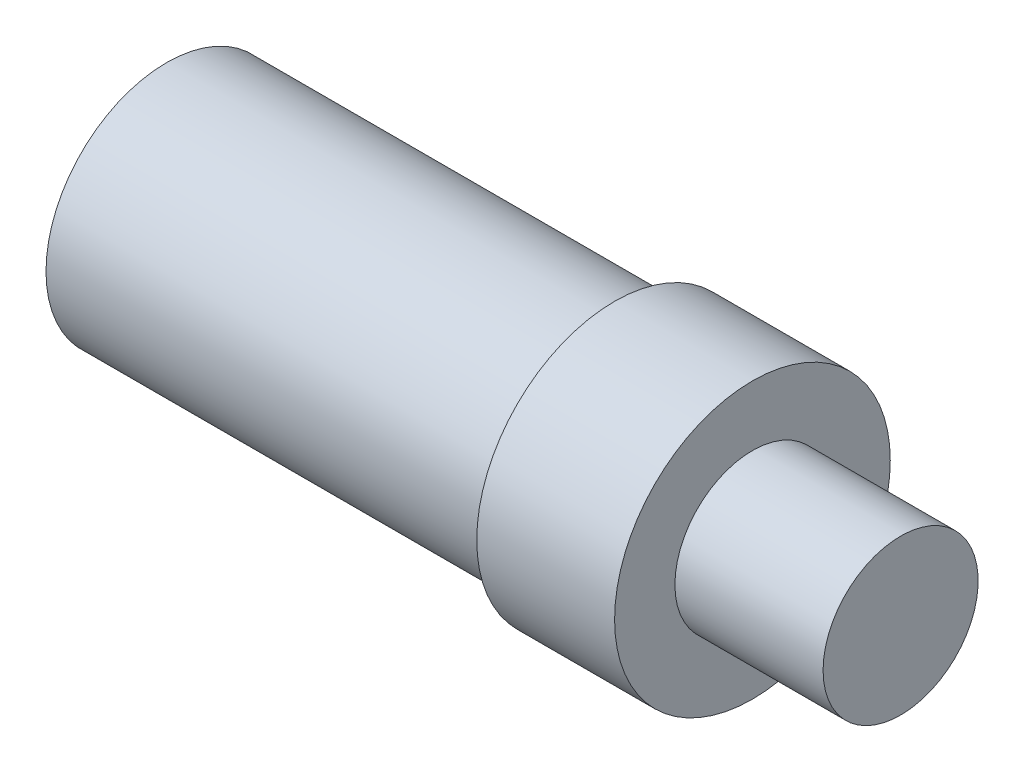
from build123d import *


with BuildPart() as part:
    # Torch_Plug Sketch → Torch_Plug (revolve)
    with BuildSketch(Plane.XY):
        Polygon((-33.4, 0), (-33.4, 4.5), (-42, 4.5), (-42, 8), (-50, 8), (-50, 7), (-76, 7), (-76, 0), align=None)
    revolve(axis=Axis((-300, 0, 0), (1, 0, 0)))


solid = part.part
